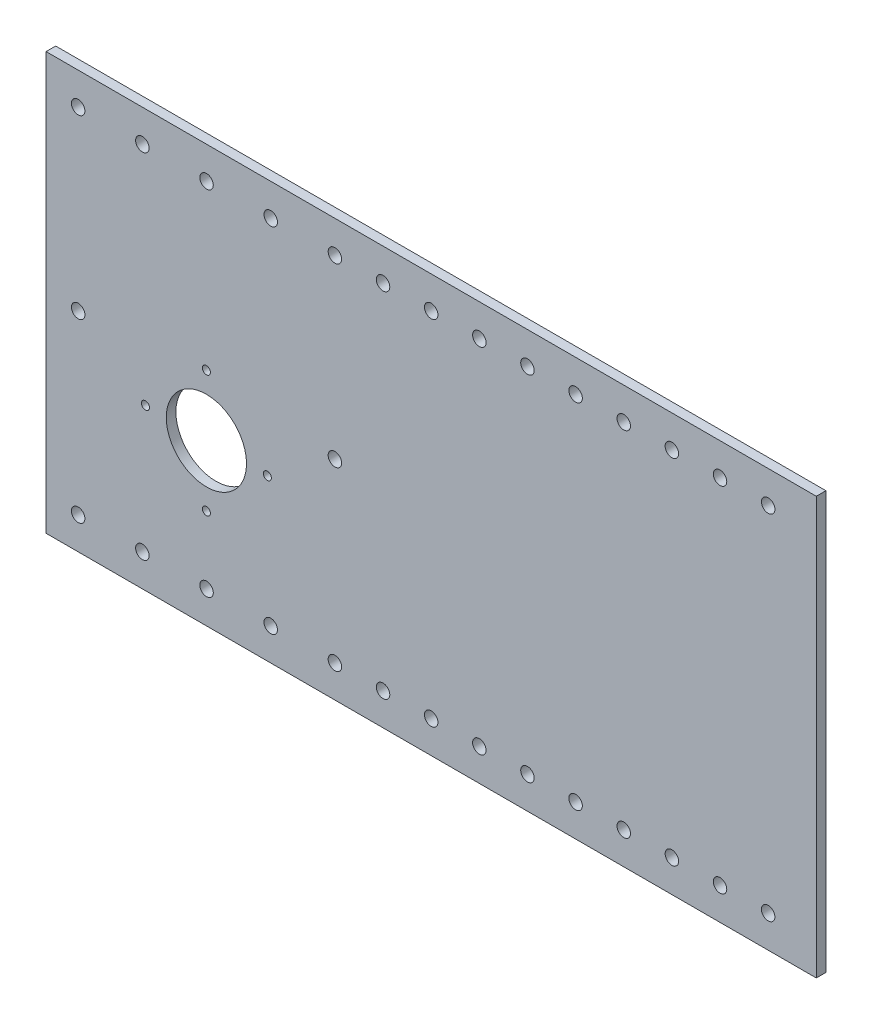
from build123d import *

# Parameters (mm, degrees)
SKETCH_1_W               = 100
SKETCH_1_H               = 130
EXTRUDE_1_DEPTH          = 3
SKETCH_2_R               = 2.1
CUT_EXTRUDE_1_DEPTH      = 83.060952956
CUT_EXTRUDE_2_DEPTH      = 83.060952956
CUT_EXTRUDE_2_DEPTH_BACK = 83.060952956
SKETCH_3_R               = 1.25
CUT_EXTRUDE_3_DEPTH      = 83.060952956
CUT_EXTRUDE_3_DEPTH_BACK = 83.060952956
SKETCH_4_R               = 12.5
SKETCH_5_W               = 140
SKETCH_5_H               = 130
EXTRUDE_2_DEPTH          = 3
CUT_EXTRUDE_4_DEPTH      = 201.833264177
CUT_EXTRUDE_4_DEPTH_BACK = 201.833264177
SKETCH_6_R               = 2.1


with BuildPart() as part:
    # 草图1 → 凸台-拉伸1 (new body)
    with BuildSketch(Plane.XY):
        Rectangle(SKETCH_1_W, SKETCH_1_H)
    extrude(amount=EXTRUDE_1_DEPTH)

    # 草图2 → 切除-拉伸1 (cut, through all)
    with BuildSketch(Plane.XY.offset(3)):
        with Locations((-40, 55)):
            Circle(SKETCH_2_R)
        with Locations((-20, 55)):
            Circle(SKETCH_2_R)
        with Locations((0, 55)):
            Circle(SKETCH_2_R)
        with Locations((20, 55)):
            Circle(SKETCH_2_R)
        with Locations((40, 55)):
            Circle(SKETCH_2_R)
        with Locations((-40, 0)):
            Circle(SKETCH_2_R)
        with Locations((-40, -55)):
            Circle(SKETCH_2_R)
        with Locations((-40, -110)):
            Circle(SKETCH_2_R)
        with Locations((-40, -165)):
            Circle(SKETCH_2_R)
        with Locations((-40, -220)):
            Circle(SKETCH_2_R)
        with Locations((-40, -275)):
            Circle(SKETCH_2_R)
        with Locations((-40, -330)):
            Circle(SKETCH_2_R)
        with Locations((-40, -385)):
            Circle(SKETCH_2_R)
        with Locations((40, -385)):
            Circle(SKETCH_2_R)
        with Locations((40, -330)):
            Circle(SKETCH_2_R)
        with Locations((40, -275)):
            Circle(SKETCH_2_R)
        with Locations((40, -220)):
            Circle(SKETCH_2_R)
        with Locations((40, -165)):
            Circle(SKETCH_2_R)
        with Locations((40, -110)):
            Circle(SKETCH_2_R)
        with Locations(Location((40, -55, 0), (0, 0, 180))):
            Circle(SKETCH_2_R)
        with Locations(Location((40, 0, 0), (0, 0, 180))):
            Circle(SKETCH_2_R)
        with Locations(Location((20, -55, 0), (0, 0, 180))):
            Circle(SKETCH_2_R)
        with Locations(Location((0, -55, 0), (0, 0, 180))):
            Circle(SKETCH_2_R)
        with Locations(Location((-20, -55, 0), (0, 0, 180))):
            Circle(SKETCH_2_R)
    extrude(amount=-CUT_EXTRUDE_1_DEPTH, mode=Mode.SUBTRACT)

    # 草图3 → 切除-拉伸2 (cut, two sides: drawn at the far end of the back side and taken through both)
    with BuildSketch(Plane(origin=(0, 0, 0), x_dir=(-1, 0, 0), z_dir=(0, 0, -1)).offset(-CUT_EXTRUDE_2_DEPTH_BACK)):
        with Locations((19.042165039, -15)):
            Circle(SKETCH_3_R)
        with Locations((0.042165039, -34)):
            Circle(SKETCH_3_R)
        with Locations((-18.957834961, -15)):
            Circle(SKETCH_3_R)
        with Locations((0.042165039, 4)):
            Circle(SKETCH_3_R)
    extrude(amount=CUT_EXTRUDE_2_DEPTH + CUT_EXTRUDE_2_DEPTH_BACK, mode=Mode.SUBTRACT)

    # 草图4 → 切除-拉伸3 (cut, two sides: drawn at the far end of the back side and taken through both)
    with BuildSketch(Plane(origin=(0, 0, 0), x_dir=(-1, 0, 0), z_dir=(0, 0, -1)).offset(-CUT_EXTRUDE_3_DEPTH_BACK)):
        with Locations((0.042165039, -15)):
            Circle(SKETCH_4_R)
    extrude(amount=CUT_EXTRUDE_3_DEPTH + CUT_EXTRUDE_3_DEPTH_BACK, mode=Mode.SUBTRACT)

    # 草图5 → 凸台-拉伸2 (add)
    with BuildSketch(Plane.XY.offset(3)):
        with Locations((120, 0)):
            Rectangle(SKETCH_5_W, SKETCH_5_H)
    extrude(amount=-EXTRUDE_2_DEPTH)

    # 草图6 → 切除-拉伸4 (cut, two sides: drawn at the far end of the back side and taken through both)
    with BuildSketch(Plane.XY.offset(3).offset(-CUT_EXTRUDE_4_DEPTH_BACK)):
        with Locations((55, 55)):
            Circle(SKETCH_6_R)
        with Locations((70, 55)):
            Circle(SKETCH_6_R)
        with Locations((85, 55)):
            Circle(SKETCH_6_R)
        with Locations((100, 55)):
            Circle(SKETCH_6_R)
        with Locations((115, 55)):
            Circle(SKETCH_6_R)
        with Locations((130, 55)):
            Circle(SKETCH_6_R)
        with Locations((145, 55)):
            Circle(SKETCH_6_R)
        with Locations((145, -55)):
            Circle(SKETCH_6_R)
        with Locations((130, -55)):
            Circle(SKETCH_6_R)
        with Locations((115, -55)):
            Circle(SKETCH_6_R)
        with Locations((100, -55)):
            Circle(SKETCH_6_R)
        with Locations((85, -55)):
            Circle(SKETCH_6_R)
        with Locations((70, -55)):
            Circle(SKETCH_6_R)
        with Locations((55, -55)):
            Circle(SKETCH_6_R)
        with Locations((160, -55)):
            Circle(SKETCH_6_R)
        with Locations((175, -55)):
            Circle(SKETCH_6_R)
        with Locations((160, 55)):
            Circle(SKETCH_6_R)
        with Locations((175, 55)):
            Circle(SKETCH_6_R)
    extrude(amount=CUT_EXTRUDE_4_DEPTH + CUT_EXTRUDE_4_DEPTH_BACK, mode=Mode.SUBTRACT)


solid = part.part
